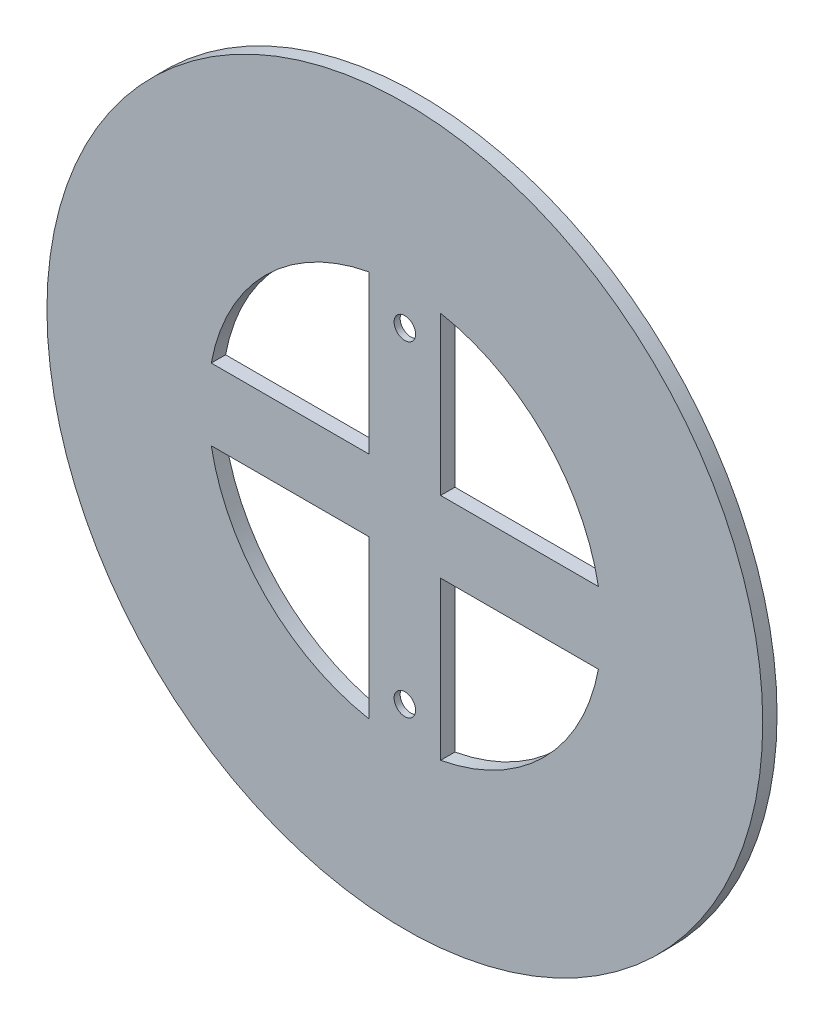
from build123d import *

# Parameters (mm, degrees)
SKETCH1_R           = 50
BOSS_EXTRUDE1_DEPTH = 2
SKETCH2_R           = 42.5
SKETCH2_R_2         = 36.25
CUT_EXTRUDE1_DEPTH  = 1
SKETCH3_R           = 1.5
CUT_EXTRUDE2_DEPTH  = 71.738956735
CHAMFER1_SIZE       = 2
CHAMFER1_SIZE2      = 1.154700538


with BuildPart() as part:
    # Sketch1 → Boss-Extrude1 (new body)
    with BuildSketch(Plane.XY):
        Circle(SKETCH1_R)
    extrude(amount=BOSS_EXTRUDE1_DEPTH)

    # Sketch2 → Cut-Extrude1 (cut)
    with BuildSketch(Plane.XY):
        Circle(SKETCH2_R)
        Circle(SKETCH2_R_2, mode=Mode.SUBTRACT)
    extrude(amount=CUT_EXTRUDE1_DEPTH, mode=Mode.SUBTRACT)

    # Sketch3 → Cut-Extrude2 (cut, through all)
    with BuildSketch(Plane(origin=(0, 0, 0), x_dir=(-1, 0, 0), z_dir=(0, 0, -1))):
        with Locations((0, 22.75)):
            Circle(SKETCH3_R)
        with Locations(Location((0, -22.75, 0), (0, 0, 180))):
            Circle(SKETCH3_R)
        with BuildLine():
            Line((-5, 27.041634566), (-5, 5))
            Line((-5, 5), (-27.041634566, 5))
            ThreePointArc((-27.041634566, 5), (-19.445436483, 19.445436483), (-5, 27.041634566))
        make_face()
        with BuildLine():
            Line((5, 27.041634566), (5, 5))
            Line((5, 5), (27.041634566, 5))
            ThreePointArc((27.041634566, 5), (19.445436483, 19.445436483), (5, 27.041634566))
        make_face()
        with BuildLine():
            Line((27.041634566, -5), (5, -5))
            Line((5, -5), (5, -27.041634566))
            ThreePointArc((5, -27.041634566), (19.445436483, -19.445436483), (27.041634566, -5))
        make_face()
        with BuildLine():
            Line((-5, -27.041634566), (-5, -5))
            Line((-5, -5), (-27.041634566, -5))
            ThreePointArc((-27.041634566, -5), (-19.445436483, -19.445436483), (-5, -27.041634566))
        make_face()
    extrude(amount=-CUT_EXTRUDE2_DEPTH, mode=Mode.SUBTRACT)

    # Chamfer1
    chamfer1_edges = [part.edges().sort_by_distance(p)[0] for p in [
        (1.5, 22.75, 0),
        (-1.5, -22.75, 0),
    ]]
    chamfer1_side = [part.faces().sort_by_distance(p)[0] for p in [
        (0, 0, 0),
    ]]
    chamfer(chamfer1_edges, length=CHAMFER1_SIZE, length2=CHAMFER1_SIZE2, reference=chamfer1_side[0])


solid = part.part
